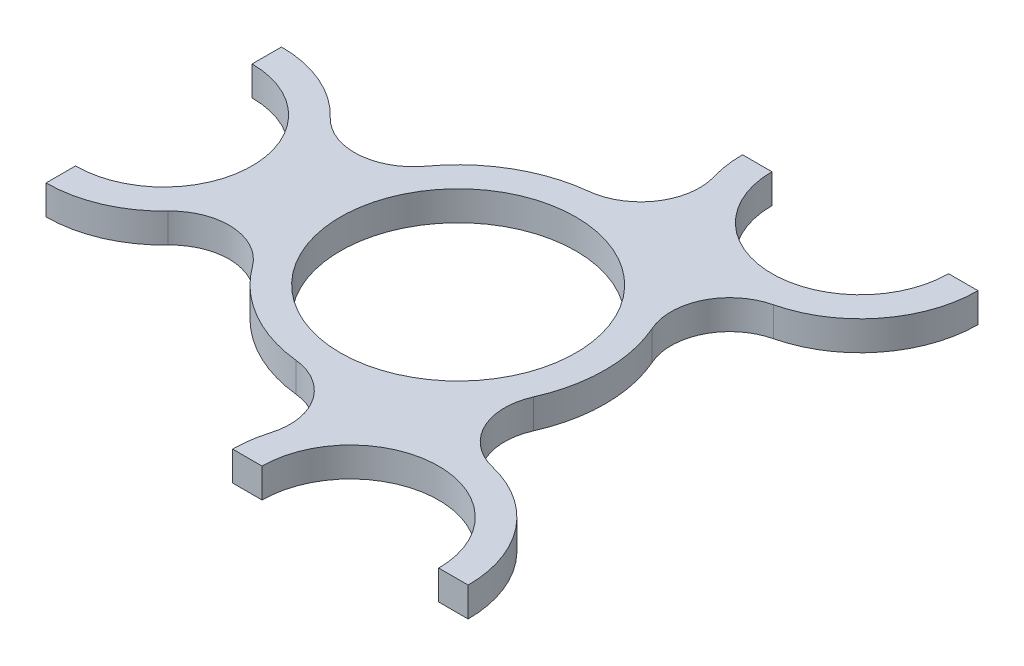
from build123d import *

# Parameters (mm, degrees)
IZIM1_R                     = 40
Y_KSEKLIK_EKSTR_ZYON1_DEPTH = 10


with BuildPart() as part:
    # Çizim1 → Yükseklik-Ekstrüzyon1 (new body)
    with BuildSketch(Plane(origin=(0, 0, 0), x_dir=(1, 0, 0), z_dir=(0, 1, 0))):
        with BuildLine():
            Line((-100, -40), (-100, -30))
            ThreePointArc((-100, -30), (-70, 0), (-100, 30))
            Line((-100, 30), (-100, 40))
            ThreePointArc((-100, 40), (-84.220237409, 36.755939555), (-71, 27.549954628))
            ThreePointArc((-71, 27.549954628), (-55.218260111, 21.366045629), (-40.357142857, 29.51780853))
            ThreePointArc((-40.357142857, 29.51780853), (-25.000226369, 43.301139494), (-5.38512036, 49.709158902))
            ThreePointArc((-5.38512036, 49.709158902), (9.104684892, 58.503090991), (11.64055433, 75.261881641))
            ThreePointArc((11.64055433, 75.261881641), (10.412263093, 80.871903754), (10, 86.6))
            Line((10, 86.6), (20, 86.6))
            ThreePointArc((20, 86.6), (50, 56.6), (80, 86.6))
            Line((80, 86.6), (90, 86.6))
            ThreePointArc((90, 86.6), (81.419623277, 61.845055583), (59.359636345, 47.710448608))
            ThreePointArc((59.359636345, 47.710448608), (46.113763964, 37.135262428), (45.742467512, 20.189766365))
            ThreePointArc((45.742467512, 20.189766365), (50, 0), (45.742467512, -20.189766365))
            ThreePointArc((45.742467512, -20.189766365), (46.113763964, -37.135262428), (59.359636345, -47.710448608))
            ThreePointArc((59.359636345, -47.710448608), (81.419623277, -61.845055583), (90, -86.6))
            Line((90, -86.6), (80, -86.6))
            ThreePointArc((80, -86.6), (50, -56.6), (20, -86.6))
            Line((20, -86.6), (10, -86.6))
            ThreePointArc((10, -86.6), (10.412263093, -80.871903754), (11.64055433, -75.261881641))
            ThreePointArc((11.64055433, -75.261881641), (9.104684892, -58.503090991), (-5.38512036, -49.709158902))
            ThreePointArc((-5.38512036, -49.709158902), (-25.000226369, -43.301139494), (-40.357142857, -29.51780853))
            ThreePointArc((-40.357142857, -29.51780853), (-55.218260111, -21.366045629), (-71, -27.549954628))
            ThreePointArc((-71, -27.549954628), (-84.220237409, -36.755939555), (-100, -40))
        make_face()
        with Locations(Location((0, 0, 0), (0, 0, 270))):
            Circle(IZIM1_R, mode=Mode.SUBTRACT)
    extrude(amount=Y_KSEKLIK_EKSTR_ZYON1_DEPTH)


solid = part.part
